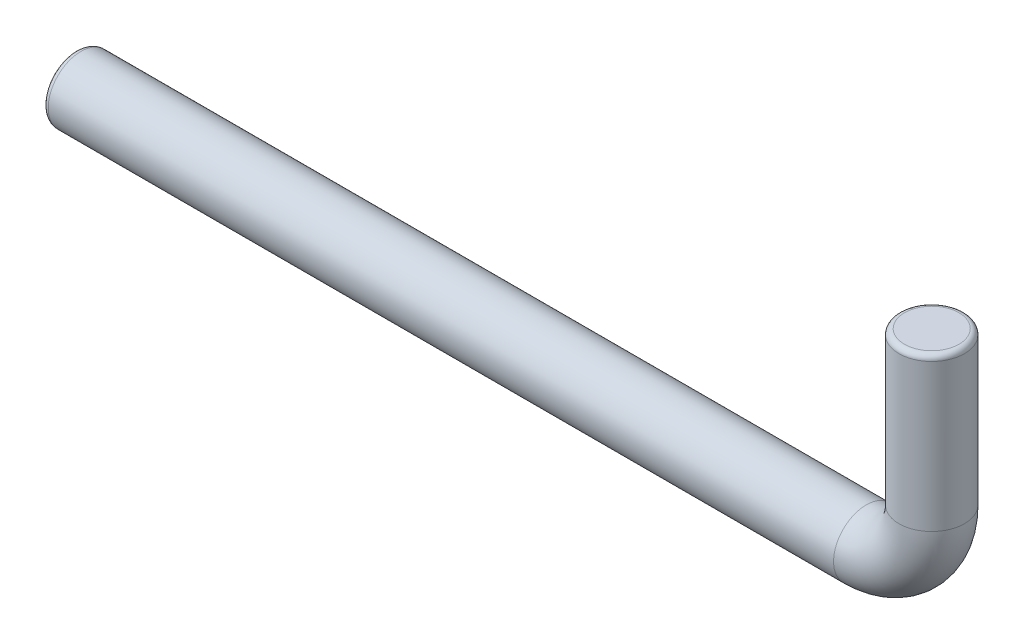
from build123d import *

# Parameters (mm, degrees)
SKETCH_4_R = 3
FILLET_2_R = 0.5


with BuildPart() as part:
    # По траектории2: sweep along a path in Эскиз2
    with BuildLine(Plane.XY) as sweep_2_path:
        Line((0, 0), (72.5, 0))
        ThreePointArc((72.5, 0), (76.742640687, 1.757359313), (78.5, 6))
        Line((78.5, 6), (78.5, 20))
    # Эскиз4 → По траектории2 (sweep)
    with BuildSketch(Plane(origin=(0, 0, 0), x_dir=(0, 0, -1), z_dir=(1, 0, 0))):
        Circle(SKETCH_4_R)
    sweep(path=sweep_2_path.line)

    # Скругление2
    fillet_2_edges = [part.edges().sort_by_distance(p)[0] for p in [
        (78.5, 20, 3),
        (0, 0, 3),
    ]]
    fillet(fillet_2_edges, radius=FILLET_2_R)


solid = part.part
